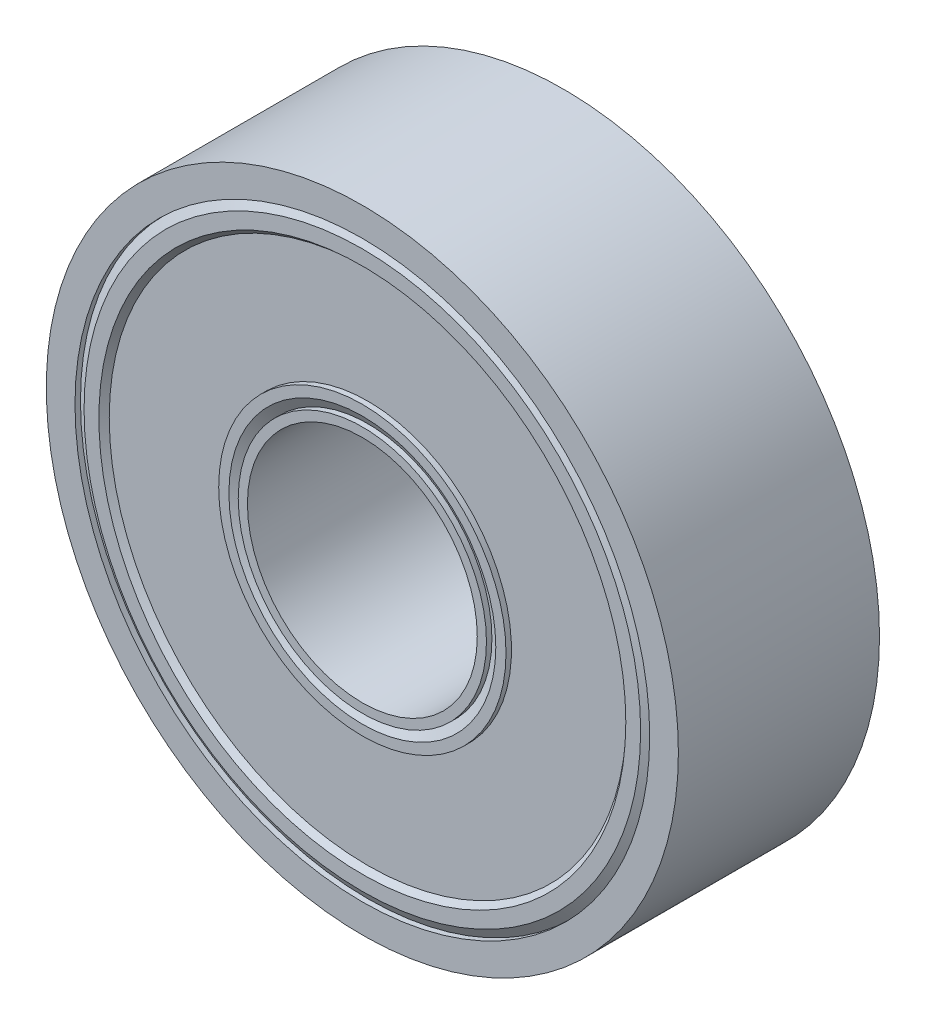
from build123d import *

# Parameters (mm, degrees)
SKETCH1_R           = 11
SKETCH1_R_2         = 4
BOSS_EXTRUDE1_DEPTH = 7


with BuildPart() as part:
    # Sketch1 → Boss-Extrude1 (new body)
    with BuildSketch(Plane.XY):
        Circle(SKETCH1_R)
        Circle(SKETCH1_R_2, mode=Mode.SUBTRACT)
    extrude(amount=BOSS_EXTRUDE1_DEPTH)

    # Sketch2 → Cut-Revolve1 (revolve, cut)
    with BuildSketch(Plane(origin=(0, 0, 0), x_dir=(1, 0, 0), z_dir=(0, 1, 0))):
        Polygon((-9, -6.809352766), (-5, -6.809352766), (-5, -7.059352766), (-4.645185355, -7), (-4.319740766, -6.809352766), (-4.319740766, -7), (0, -7), (0, -9.290623362), (-10.991354846, -9.290623362), (-10.991354846, -7.309352766), (-10.001460887, -7.309352766), (-10.001460887, -6.809352766), (-9.350571708, -7.202353914), align=None)
        Polygon((-4.645185355, 0), (-5, 0.059352766), (-5, -0.190647234), (-9, -0.190647234), (-9.350571708, 0.202353914), (-10.001460887, -0.190647234), (-10.001460887, 0.309352766), (-10.991354846, 0.309352766), (-10.991354846, 2.290623362), (0, 2.290623362), (0, 0), (-4.319740766, 0), (-4.319740766, -0.190647234), align=None)
    revolve(axis=Axis((0, 0, 0), (0, 0, 1)), mode=Mode.SUBTRACT)


solid = part.part
